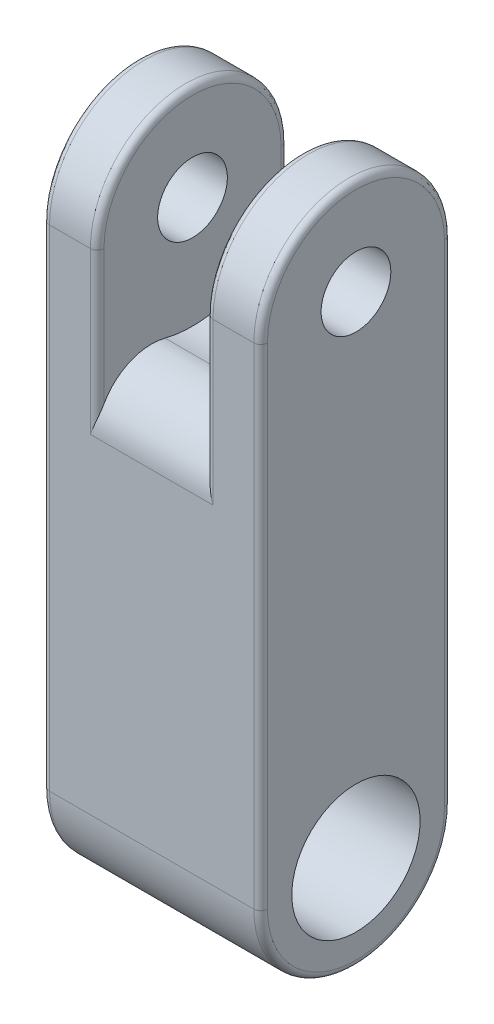
from build123d import *

# Parameters (mm, degrees)
SKETCH1_R           = 3.739497694
SKETCH1_R_2         = 2.032
BOSS_EXTRUDE1_DEPTH = 6.35
SKETCH2_R           = 6.5
CUT_EXTRUDE1_DEPTH  = 3.175
FILLET1_R           = 3.175
FILLET2_R           = 0.396875


with BuildPart() as part:
    # Sketch1 → Boss-Extrude1 (new, symmetric)
    with BuildSketch(Plane(origin=(0, 0, 0), x_dir=(0, 0, -1), z_dir=(1, 0, 0))):
        with BuildLine():
            Line((-5.55625, 0), (-5.55625, 28.575))
            ThreePointArc((-5.55625, 28.575), (0, 34.13125), (5.55625, 28.575))
            Line((5.55625, 28.575), (5.55625, 0))
            ThreePointArc((5.55625, 0), (0, -5.55625), (-5.55625, 0))
        make_face()
        Circle(SKETCH1_R, mode=Mode.SUBTRACT)
        with Locations((0, 28.575)):
            Circle(SKETCH1_R_2, mode=Mode.SUBTRACT)
    extrude(amount=BOSS_EXTRUDE1_DEPTH, both=True)

    # Sketch2 → Cut-Extrude1 (cut, symmetric)
    with BuildSketch(Plane(origin=(0, 0, 0), x_dir=(0, 0, -1), z_dir=(1, 0, 0))):
        with Locations((0, 28.575)):
            Circle(SKETCH2_R)
    extrude(amount=CUT_EXTRUDE1_DEPTH, both=True, mode=Mode.SUBTRACT)

    # Fillet1
    fillet1_edges = [part.edges().sort_by_distance(p)[0] for p in [
        (0, 25.20185815, 5.55625),
        (0, 25.20185815, -5.55625),
    ]]
    fillet(fillet1_edges, radius=FILLET1_R)

    # Fillet2
    fillet2_edges = [part.edges().sort_by_distance(p)[0] for p in [
        (6.35, 34.13125, 0),
        (6.35, 14.2875, 5.55625),
        (3.175, 23.886309526, -5.55625),
        (3.175, 34.13125, 0),
        (3.175, 23.886309526, 5.55625),
        (-3.175, 23.886309526, -5.55625),
        (-3.175, 34.13125, 0),
        (-3.175, 23.886309526, 5.55625),
        (6.35, -5.55625, 0),
        (-6.35, 14.2875, 5.55625),
        (-6.35, 34.13125, 0),
        (-6.35, 14.2875, -5.55625),
        (-6.35, -5.55625, 0),
        (6.35, 14.2875, -5.55625),
    ]]
    fillet(fillet2_edges, radius=FILLET2_R)


solid = part.part
